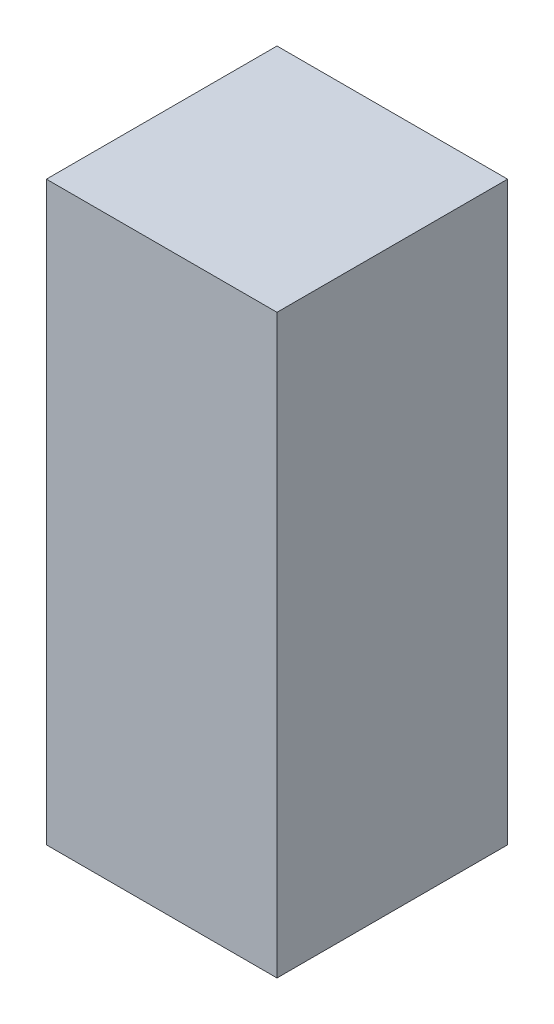
from build123d import *

# Parameters (mm, degrees)
SKETCH_1_W      = 40
SKETCH_1_H      = 40
EXTRUDE_1_DEPTH = 100


with BuildPart() as part:
    # Эскиз1 → Бобышка-Вытянуть1 (new body)
    with BuildSketch(Plane(origin=(0, 0, 0), x_dir=(1, 0, 0), z_dir=(0, 1, 0))):
        with Locations((-467.247374962, -667.030369645)):
            Rectangle(SKETCH_1_W, SKETCH_1_H)
    extrude(amount=EXTRUDE_1_DEPTH)


solid = part.part
